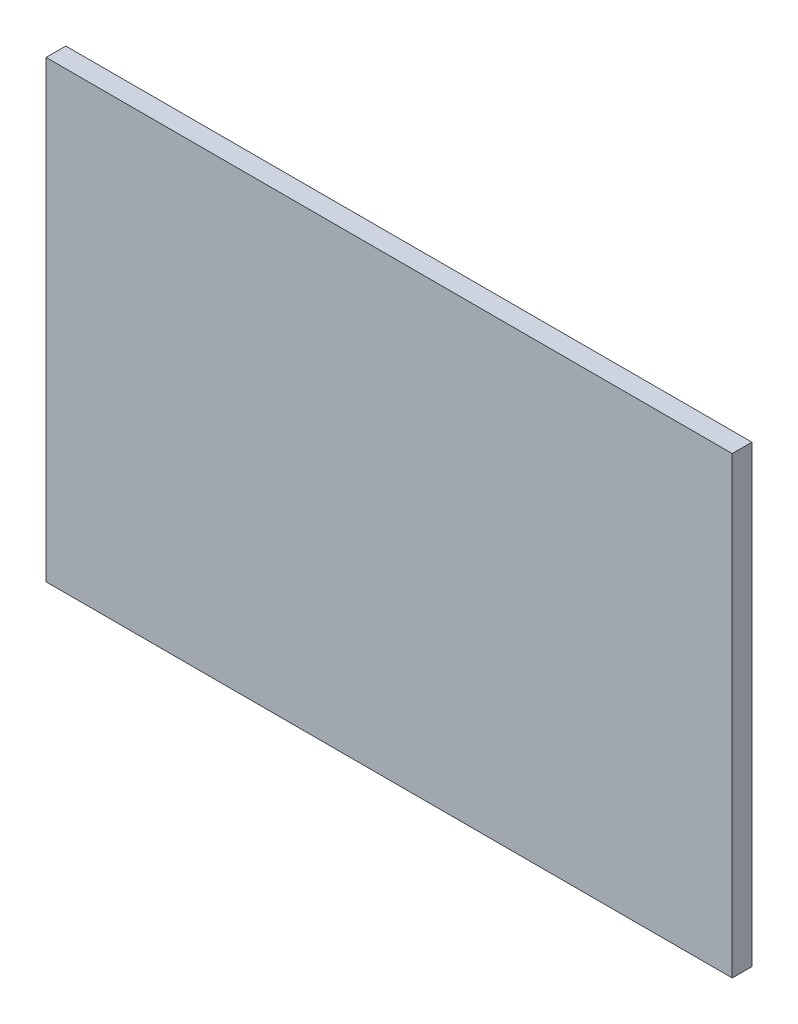
from build123d import *

# Parameters (mm, degrees)
SKETCH5_W           = 417
SKETCH5_H           = 276
BOSS_EXTRUDE3_DEPTH = 12


with BuildPart() as part:
    # Sketch5 → Boss-Extrude3 (new body)
    with BuildSketch(Plane.XY):
        with Locations((208.5, 138)):
            Rectangle(SKETCH5_W, SKETCH5_H)
    extrude(amount=BOSS_EXTRUDE3_DEPTH)


solid = part.part
